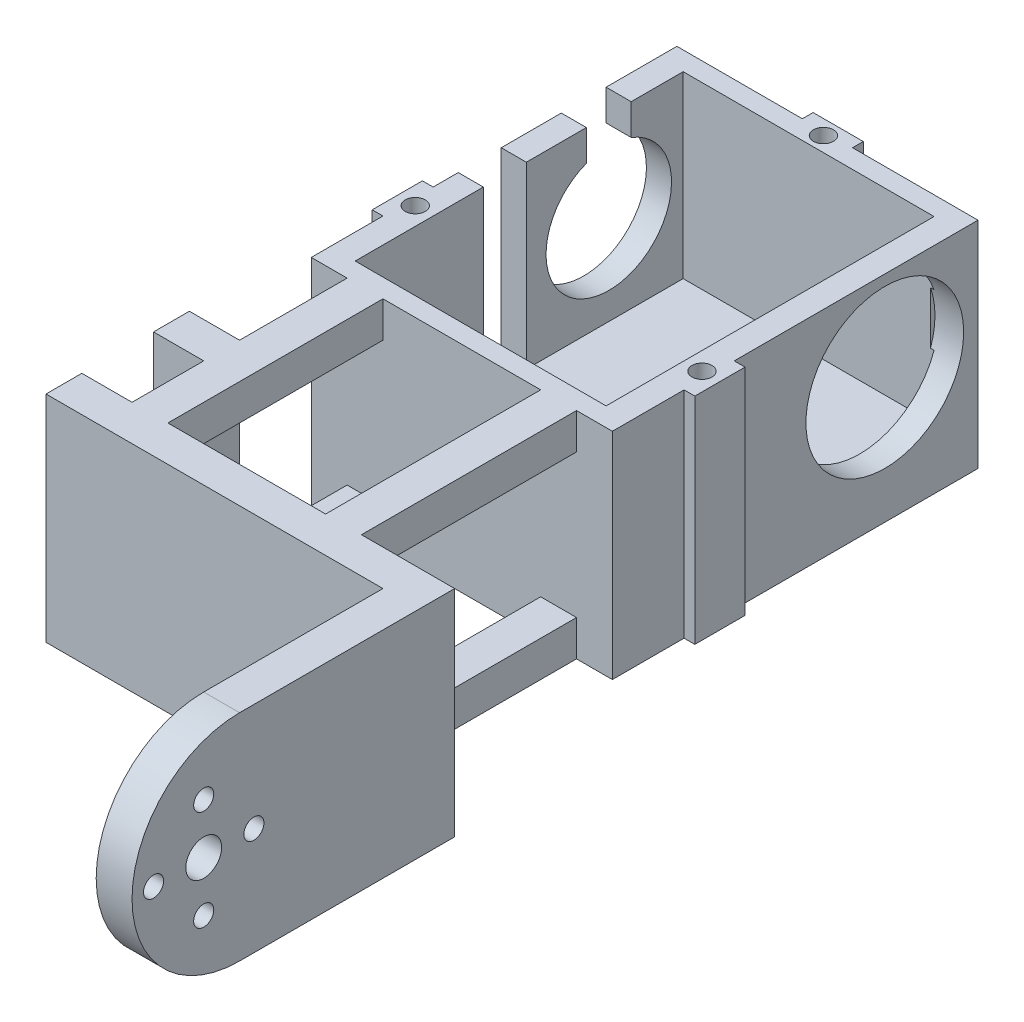
from build123d import *

# Parameters (mm, degrees)
BOSS_EXTRUDE1_DEPTH = 5
SKETCH3_W           = 42
SKETCH3_H           = 51
SKETCH3_W_2         = 35
SKETCH3_H_2         = 45.75
BOSS_EXTRUDE3_DEPTH = 25
SKETCH4_R           = 8.75
CUT_EXTRUDE2_DEPTH  = 5
CUT_EXTRUDE3_DEPTH  = 4
SKETCH7_W           = 6
SKETCH7_H           = 25
CUT_EXTRUDE4_DEPTH  = 4
SKETCH9_R           = 11
CUT_EXTRUDE5_DEPTH  = 4
SKETCH16_W          = 7
SKETCH16_H          = 30
BOSS_EXTRUDE5_DEPTH = 1.5
SKETCH17_W          = 7
SKETCH17_H          = 30
BOSS_EXTRUDE6_DEPTH = 1.5
SKETCH19_W          = 7
SKETCH19_H          = 30
BOSS_EXTRUDE7_DEPTH = 1.5
SKETCH18_R          = 1.4
CUT_EXTRUDE7_DEPTH  = 6
BOSS_EXTRUDE8_DEPTH = 30
SKETCH24_W          = 30
SKETCH24_H          = 20
CUT_EXTRUDE8_DEPTH  = 32
SKETCH29_R          = 1.4
CUT_EXTRUDE9_DEPTH  = 6
CUT_EXTRUDE10_DEPTH = 6
SKETCH28_R          = 2.5
SKETCH28_R_2        = 1.4
CUT_EXTRUDE11_DEPTH = 6


with BuildPart() as part:
    # Sketch1 → Boss-Extrude1 (new body)
    with BuildSketch(Plane(origin=(0, 0, 0), x_dir=(1, 0, 0), z_dir=(0, 1, 0))):
        Polygon((21, 25.5), (-21, 25.5), (-21, -25.5), (-16, -25.5), (-11, -25.5), (11, -25.5), (16, -25.5), (21, -25.5), align=None)
    extrude(amount=BOSS_EXTRUDE1_DEPTH)

    # Sketch3 → Boss-Extrude3 (add)
    with BuildSketch(Plane(origin=(0, 5, 0), x_dir=(1, 0, 0), z_dir=(0, 1, 0))):
        Rectangle(SKETCH3_W, SKETCH3_H)
        Rectangle(SKETCH3_W_2, SKETCH3_H_2, mode=Mode.SUBTRACT)
    extrude(amount=BOSS_EXTRUDE3_DEPTH)

    # Sketch4 → Cut-Extrude2 (cut)
    with BuildSketch(Plane.ZY.offset(21)):
        with Locations((-12.5, 17.5)):
            Circle(SKETCH4_R)
    extrude(amount=-CUT_EXTRUDE2_DEPTH, mode=Mode.SUBTRACT)

    # Sketch6 → Cut-Extrude3 (cut)
    with BuildSketch(Plane(origin=(-17.5, 0, 0), x_dir=(0, 0, -1), z_dir=(1, 0, 0))):
        with BuildLine():
            Line((9.375, 17.5), (9.375, 30))
            Line((9.375, 30), (15.625, 30))
            Line((15.625, 30), (15.625, 17.5))
            ThreePointArc((15.625, 17.5), (12.5, 14.375), (9.375, 17.5))
        make_face()
    extrude(amount=-CUT_EXTRUDE3_DEPTH, mode=Mode.SUBTRACT)

    # Sketch7 → Cut-Extrude4 (cut)
    with BuildSketch(Plane.ZY.offset(21)):
        with Locations((2, 17.5)):
            Rectangle(SKETCH7_W, SKETCH7_H)
    extrude(amount=-CUT_EXTRUDE4_DEPTH, mode=Mode.SUBTRACT)

    # Sketch9 → Cut-Extrude5 (cut)
    with BuildSketch(Plane(origin=(21, 0, 0), x_dir=(0, 0, -1), z_dir=(1, 0, 0))):
        with Locations((12.5, 17.5)):
            Circle(SKETCH9_R)
    extrude(amount=-CUT_EXTRUDE5_DEPTH, mode=Mode.SUBTRACT)

    # Sketch16 → Boss-Extrude5 (add)
    with BuildSketch(Plane.ZY.offset(21)):
        with Locations((12, 15)):
            Rectangle(SKETCH16_W, SKETCH16_H)
    extrude(amount=BOSS_EXTRUDE5_DEPTH)

    # Sketch17 → Boss-Extrude6 (add)
    with BuildSketch(Plane(origin=(21, 0, 0), x_dir=(0, 0, -1), z_dir=(1, 0, 0))):
        with Locations((-12, 15)):
            Rectangle(SKETCH17_W, SKETCH17_H)
    extrude(amount=BOSS_EXTRUDE6_DEPTH)

    # Sketch19 → Boss-Extrude7 (add)
    with BuildSketch(Plane(origin=(0, 0, -25.5), x_dir=(-1, 0, 0), z_dir=(0, 0, -1))):
        with Locations((0, 15)):
            Rectangle(SKETCH19_W, SKETCH19_H)
    extrude(amount=BOSS_EXTRUDE7_DEPTH)

    # Sketch18 → Cut-Extrude7 (cut)
    with BuildSketch(Plane(origin=(0, 30, 0), x_dir=(1, 0, 0), z_dir=(0, 1, 0))):
        with Locations((-20, -12)):
            Circle(SKETCH18_R)
        with Locations((20, -12)):
            Circle(SKETCH18_R)
        with Locations((0, 24.9375)):
            Circle(SKETCH18_R)
    extrude(amount=-CUT_EXTRUDE7_DEPTH, mode=Mode.SUBTRACT)

    # Sketch1<3> → Boss-Extrude8 (add)
    with BuildSketch(Plane(origin=(0, 0, 0), x_dir=(1, 0, 0), z_dir=(0, 1, 0))):
        Polygon((-11, -25.5), (-16, -25.5), (-16, -40.5), (-23, -40.5), (-23, -45.5), (-16, -45.5), (-16, -55.5), (-23, -55.5), (-23, -60.5), (24, -60.5), (24, -100.5), (29, -100.5), (29, -55.5), (16, -55.5), (16, -25.5), (11, -25.5), (11, -55.5), (-11, -55.5), align=None)
    extrude(amount=BOSS_EXTRUDE8_DEPTH)

    # Sketch24 → Cut-Extrude8 (cut)
    with BuildSketch(Plane.ZY.offset(16)):
        with Locations((40.5, 15)):
            Rectangle(SKETCH24_W, SKETCH24_H)
    extrude(amount=-CUT_EXTRUDE8_DEPTH, mode=Mode.SUBTRACT)

    # Sketch29 → Cut-Extrude9 (cut)
    with BuildSketch(Plane.ZY.offset(23)):
        with Locations((58, 25)):
            Circle(SKETCH29_R)
        with Locations((43, 25)):
            Circle(SKETCH29_R)
        with Locations((58, 5)):
            Circle(SKETCH29_R)
        with Locations((43, 5)):
            Circle(SKETCH29_R)
    extrude(amount=-CUT_EXTRUDE9_DEPTH, mode=Mode.SUBTRACT)

    # Sketch30 → Cut-Extrude10 (cut)
    with BuildSketch(Plane(origin=(29, 0, 0), x_dir=(0, 0, -1), z_dir=(1, 0, 0))):
        with BuildLine():
            ThreePointArc((-100.5, 15), (-96.106601718, 25.606601718), (-85.5, 30))
            Line((-85.5, 30), (-100.5, 30))
            Line((-100.5, 30), (-100.5, 15))
        make_face()
        with BuildLine():
            ThreePointArc((-85.5, 0), (-96.106601718, 4.393398282), (-100.5, 15))
            Line((-100.5, 15), (-100.5, 0))
            Line((-100.5, 0), (-85.5, 0))
        make_face()
    extrude(amount=-CUT_EXTRUDE10_DEPTH, mode=Mode.SUBTRACT)

    # Sketch28 → Cut-Extrude11 (cut)
    with BuildSketch(Plane.ZY.offset(-24)):
        with Locations((90.5, 15)):
            Circle(SKETCH28_R)
        with Locations((90.5, 22)):
            Circle(SKETCH28_R_2)
        with Locations((83.5, 15)):
            Circle(SKETCH28_R_2)
        with Locations((90.5, 8)):
            Circle(SKETCH28_R_2)
        with Locations((97.5, 15)):
            Circle(SKETCH28_R_2)
    extrude(amount=-CUT_EXTRUDE11_DEPTH, mode=Mode.SUBTRACT)


solid = part.part
